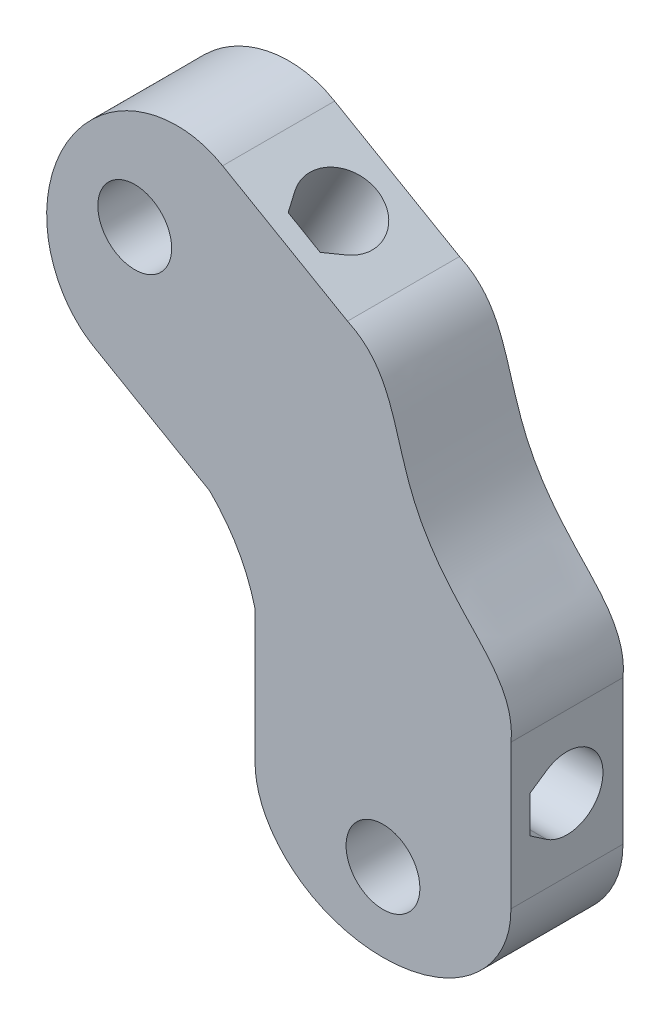
from build123d import *

# Parameters (mm, degrees)
MODEL_R               = 4.350000706
MODEL_R_2             = 4.349999799
MAIN_BODY_DEPTH       = 13.2
SIDE_UP_GRAPHIC_DEPTH = 1
HOLE_1_REACH          = 105.138
HOLE_2_REACH          = 92.65


with BuildPart() as part:
    # Model → Main body (new body)
    with BuildSketch(Plane.XY):
        with BuildLine():
            Line((-32.385278451, 85.015032789), (-17.6641047, 76.515992185))
            add(Edge.make_bspline(
                [(-17.6641047, 76.515992185), (-13.888722486, 74.796310284), (-12.180872386, 69.346040832), (-10.138677855, 62.322648799), (-7.341971962, 57.370319929), (-2.311165044, 51.709551581), (2.051636145, 47.586423037), (1.587639106, 43.172213575)],
                knots=[0, 0, 0, 0, 0.279425433, 0.41981198, 0.560237256, 0.707310001, 1, 1, 1, 1], degree=3))
            Line((1.587639106, 43.172213575), (1.587638631, 26.172213575))
            add(Edge.make_bspline(
                [(1.587638631, 26.172213575), (1.626935513, 22.433749487), (-1.504300665, 17.452795295), (-8.065829548, 14.211603151), (-13.487361838, 13.402379484), (-18.908893689, 14.211603727), (-25.470424367, 17.452793212), (-28.601657646, 22.43375075), (-28.56236242, 26.172213575)],
                knots=[0, 0, 0, 0, 0.249525848, 0.374711548, 0.499999996, 0.625288445, 0.750474147, 1, 1, 1, 1], degree=3))
            Line((-28.56236242, 26.172213575), (-28.56236242, 41.723666211))
            add(Edge.make_bspline(
                [(-33.914159524, 51.083510419), (-29.942183369, 47.173551609), (-28.56236242, 41.723666211)],
                knots=[0, 0, 0, 1, 1, 1], degree=2))
            Line((-33.914159524, 51.083510419), (-47.460258007, 58.904368421))
            add(Edge.make_bspline(
                [(-32.385278451, 85.015032789), (-35.600190369, 86.916553219), (-41.474036655, 86.698356276), (-47.559386008, 82.644557032), (-50.972092804, 78.360730829), (-52.985254476, 73.268128205), (-53.475705817, 65.95976879), (-50.710025567, 60.754293561), (-47.460258007, 58.904368421)],
                knots=[0, 0, 0, 0, 0.249337779, 0.374428166, 0.499621296, 0.624814359, 0.749906039, 1, 1, 1, 1], degree=3))
        make_face()
        with Locations((-13.487362418, 22.922213336)):
            Circle(MODEL_R, mode=Mode.SUBTRACT)
        with Locations((-42.737362401, 73.584699743)):
            Circle(MODEL_R_2, mode=Mode.SUBTRACT)
    extrude(amount=MAIN_BODY_DEPTH)

    # Model<4> → Side up graphic (cut)
    with BuildSketch(Plane.XY):
        Polygon((-23.949281442, 53.735095044), (-15.80864309, 58.435095807), (-17.1586416, 60.773364149), (-25.299281823, 56.073363324), (-26.59928106, 58.325030347), (-29.325818765, 52.247530958), (-22.649282205, 51.483428022), align=None)
        Polygon((-25.075818765, 44.886315366), (-18.399280297, 44.122214338), (-19.649280297, 46.287276288), (-11.508643853, 50.987277051), (-12.9086416, 53.412150465), (-21.049281823, 48.71214964), (-22.34928106, 50.963812848), align=None)
        Polygon((-10.0256307, 49.418623945), (-7.68736242, 50.768622419), (-15.537360894, 64.365221998), (-17.875629174, 63.015223523), align=None)
    extrude(amount=SIDE_UP_GRAPHIC_DEPTH, mode=Mode.SUBTRACT)

    # Schizzo3 → Hole 1 (cut, up to next)
    with BuildSketch(Plane(origin=(1.587637901, -4.4e-08, 0), x_dir=(0, 0, -1), z_dir=(0.9999999999999997, -2.789602577989315e-08, 0)), mode=Mode.PRIVATE) as hole_1_sk1:
        with BuildLine():
            Line((-10.95, 32.497213619), (-10.95, 36.847213619))
            Line((-10.95, 36.847213619), (-8.99780105, 38.181209219))
            ThreePointArc((-8.99780105, 38.181209219), (-2.35, 34.672213619), (-8.99780105, 31.163218019))
            Line((-8.99780105, 31.163218019), (-10.95, 32.497213619))
        make_face()
    hole_1_tool1 = extrude(hole_1_sk1.sketch, amount=-HOLE_1_REACH, mode=Mode.PRIVATE) & part.part
    add(hole_1_tool1.solids().sort_by_distance((1.587639, 34.672214, 6.73262))[0], mode=Mode.SUBTRACT)

    # Schizzo4 → Hole 2 (cut, up to next)
    with BuildSketch(Plane(origin=(28.716097743, 49.739103981, 0), x_dir=(0.8660313397108585, -0.499989718532907, 0), z_dir=(0.49998971853290697, 0.8660313397108584, 0)), mode=Mode.PRIVATE) as hole_2_sk1:
        with BuildLine():
            Line((-64.229093026, -10.95), (-59.879093026, -10.95))
            Line((-59.879093026, -10.95), (-58.545097426, -8.99780105))
            ThreePointArc((-58.545097426, -8.99780105), (-62.054093026, -2.35), (-65.563088627, -8.99780105))
            Line((-65.563088627, -8.99780105), (-64.229093026, -10.95))
        make_face()
    hole_2_tool1 = extrude(hole_2_sk1.sketch, amount=-HOLE_2_REACH, mode=Mode.PRIVATE) & part.part
    add(hole_2_tool1.solids().sort_by_distance((-25.024692, 80.765512, 6.73262))[0], mode=Mode.SUBTRACT)


solid = part.part
